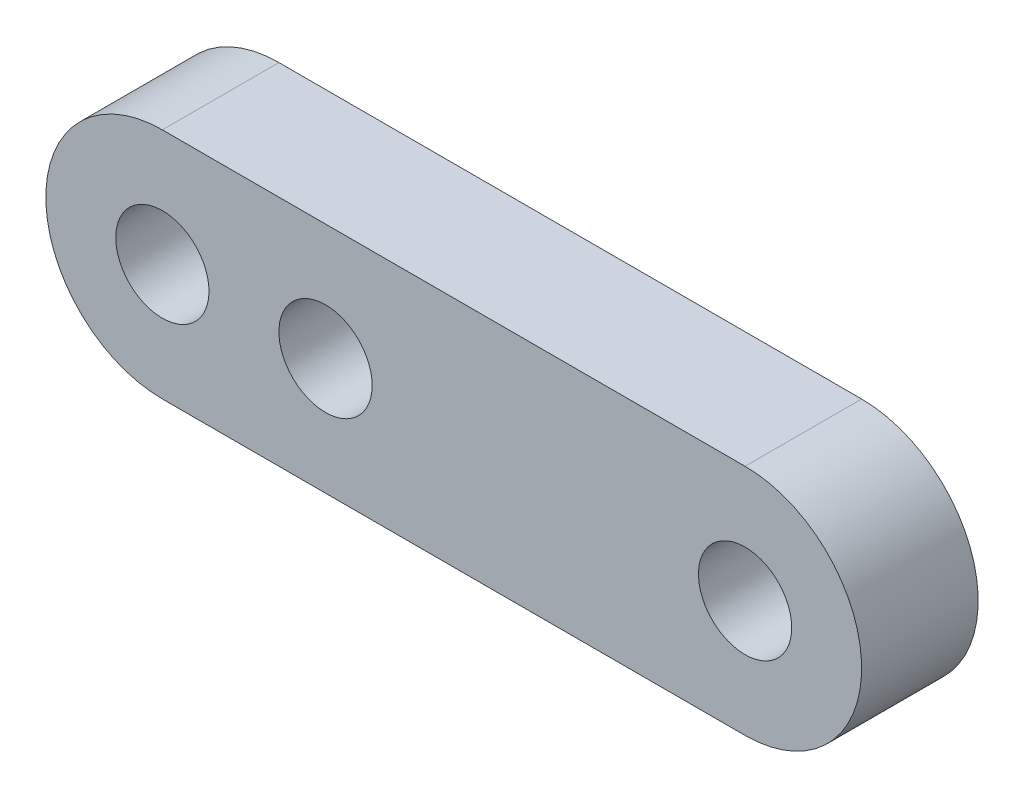
from build123d import *

# Parameters (mm, degrees)
SKETCH1_R           = 2
BOSS_EXTRUDE2_DEPTH = 5


with BuildPart() as part:
    # Sketch1 → Boss-Extrude2 (new body)
    with BuildSketch(Plane.XY):
        with BuildLine():
            Line((-15, 5), (10, 5))
            ThreePointArc((10, 5), (15, 0), (10, -5))
            Line((10, -5), (-15, -5))
            ThreePointArc((-15, -5), (-20, 0), (-15, 5))
        make_face()
        with Locations((10, 0)):
            Circle(SKETCH1_R, mode=Mode.SUBTRACT)
        with Locations((-15, 0)):
            Circle(SKETCH1_R, mode=Mode.SUBTRACT)
        with Locations((-8, 0)):
            Circle(SKETCH1_R, mode=Mode.SUBTRACT)
    extrude(amount=BOSS_EXTRUDE2_DEPTH)


solid = part.part
